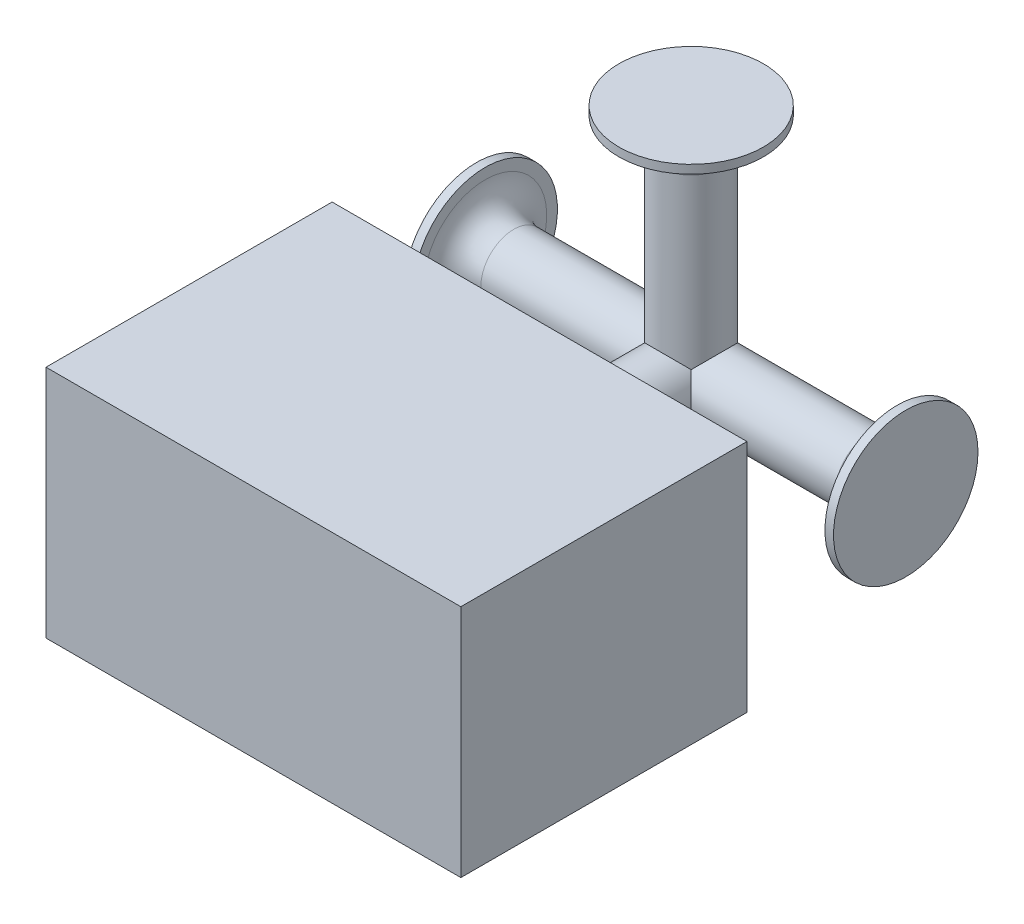
from build123d import *

# Parameters (mm, degrees)
SKETCH_2_R      = 25.25
EXTRUDE_1_DEPTH = 3
SKETCH_3_R      = 11.5
EXTRUDE_2_DEPTH = 77
SKETCH_4_R      = 11.5
EXTRUDE_3_DEPTH = 72
SKETCH_5_R      = 25.25
EXTRUDE_4_DEPTH = 3
EXTRUDE_START   = 3
SKETCH_6_R      = 25.25
EXTRUDE_5_DEPTH = 3
FILLET_1_R      = 10
SKETCH_7_R      = 11.5
EXTRUDE_6_DEPTH = 53
SKETCH_8_W      = 145
SKETCH_8_H      = 100
EXTRUDE_7_DEPTH = 41


with BuildPart() as part:
    # 스케치2 → 보스-돌출1 (new body)
    with BuildSketch(Plane(origin=(0, 0, 0), x_dir=(1, 0, 0), z_dir=(0, 1, 0))):
        Circle(SKETCH_2_R)
    extrude(amount=-EXTRUDE_1_DEPTH)

    # 스케치3 → 보스-돌출2 (add)
    with BuildSketch(Plane.XZ.offset(3)):
        Circle(SKETCH_3_R)
    extrude(amount=EXTRUDE_2_DEPTH)

    # 스케치4 → 보스-돌출3 (add, symmetric)
    with BuildSketch(Plane(origin=(0, 0, 0), x_dir=(0, 0, -1), z_dir=(1, 0, 0))):
        with Locations((0, -80)):
            Circle(SKETCH_4_R)
    extrude(amount=EXTRUDE_3_DEPTH, both=True)

    # 스케치5 → 보스-돌출4 (add)
    with BuildSketch(Plane(origin=(72, 0, 0), x_dir=(0, 0, -1), z_dir=(1, 0, 0))):
        with Locations((0, -80)):
            Circle(SKETCH_5_R)
    extrude(amount=EXTRUDE_4_DEPTH)

    # 스케치6 → 보스-돌출5 (add)
    with BuildSketch(Plane.ZY.offset(72).offset(EXTRUDE_START)):
        with Locations((0, -80)):
            Circle(SKETCH_6_R)
    extrude(amount=-EXTRUDE_5_DEPTH)

    # 필렛1
    fillet_1_edges = [part.edges().sort_by_distance(p)[0] for p in [
        (-72, -80, 11.5),
        (-11.5, -3, 0),
        (72, -80, 11.5),
    ]]
    fillet(fillet_1_edges, radius=FILLET_1_R)

    # 스케치7 → 보스-돌출6 (add)
    with BuildSketch(Plane.XY):
        with Locations((0, -80)):
            Circle(SKETCH_7_R)
    extrude(amount=EXTRUDE_6_DEPTH)

    # 스케치8 → 보스-돌출7 (add, symmetric)
    with BuildSketch(Plane(origin=(0, -80, 0), x_dir=(1, 0, 0), z_dir=(0, 1, 0))):
        with Locations((0, -103)):
            Rectangle(SKETCH_8_W, SKETCH_8_H)
    extrude(amount=EXTRUDE_7_DEPTH, both=True)


solid = part.part
